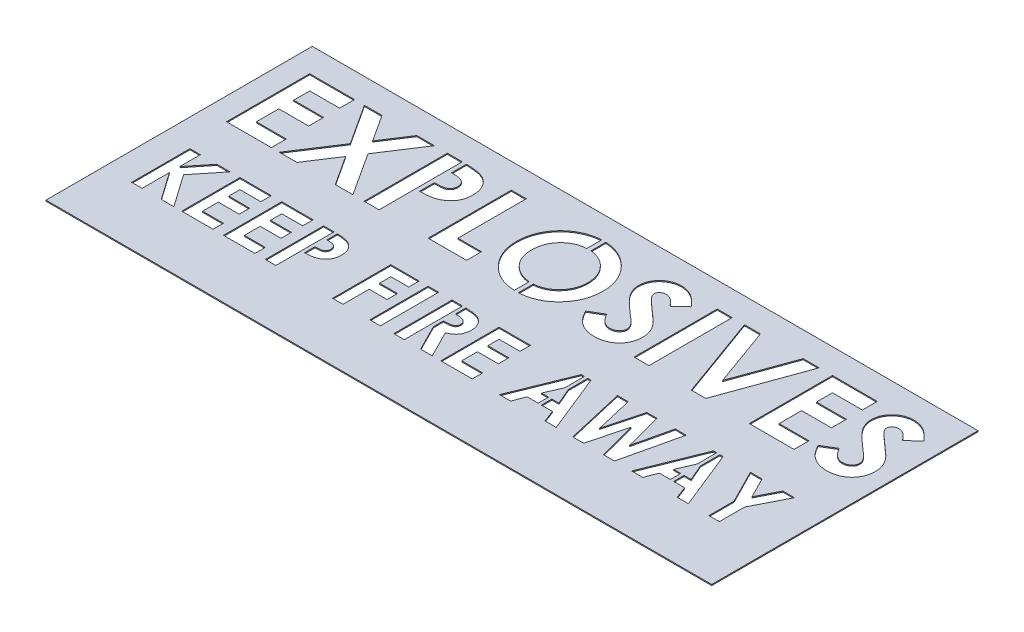
from build123d import *

# Parameters (mm, degrees)
SKETCH1_W           = 254
SKETCH1_H           = 101.6
BOSS_EXTRUDE1_DEPTH = 0.4
SKETCH2_W           = 5.698717948
SKETCH2_H           = 31.75
SKETCH2_W_2         = 3.989102564
SKETCH2_H_2         = 22.225
CUT_EXTRUDE1_DEPTH  = 137.783770967
BOSS_EXTRUDE6_DEPTH = 0.4


with BuildPart() as part:
    # Sketch1 → Boss-Extrude1 (new body)
    with BuildSketch(Plane(origin=(0, 0, 0), x_dir=(1, 0, 0), z_dir=(0, 1, 0))):
        Rectangle(SKETCH1_W, SKETCH1_H)
    extrude(amount=BOSS_EXTRUDE1_DEPTH)

    # Sketch2 → Cut-Extrude1 (cut, through all)
    # profile 1 of 22: a face of its own
    with BuildSketch(Plane(origin=(0, 0.4, 0), x_dir=(1, 0, 0), z_dir=(0, 1, 0))):
        Polygon((-118.451923077, 41.275), (-101.355769231, 41.275), (-101.355769231, 35.576282051), (-112.753205128, 35.576282051), (-112.753205128, 29.470512821), (-101.355769231, 29.470512821), (-101.355769231, 23.771794872), (-112.753205128, 23.771794872), (-112.753205128, 15.223717949), (-101.355769231, 15.223717949), (-101.355769231, 9.525), (-118.451923077, 9.525), align=None)
    # profile 2 of 22: a face of its own
    with BuildSketch(Plane(origin=(0, 0.4, 0), x_dir=(1, 0, 0), z_dir=(0, 1, 0))):
        Polygon((-97.596905048, 41.275), (-90.880558894, 41.275), (-84.246895032, 31.07963742), (-77.600510817, 41.275), (-70.865084135, 41.275), (-80.882361779, 25.915174279), (-70.216346154, 9.525), (-76.932692308, 9.525), (-84.246895032, 20.76343149), (-91.573818109, 9.525), (-98.302884615, 9.525), (-87.605068109, 25.927894631), align=None)
    # profile 3 of 22: a face of its own
    with BuildSketch(Plane(origin=(0, 0.4, 0), x_dir=(1, 0, 0), z_dir=(0, 1, 0))):
        with BuildLine():
            Line((-65.942307692, 41.275), (-59.58213141, 41.275))
            add(Edge.make_bspline(
                [(-59.58213141, 41.275), (-59.166565743, 41.27313984), (-58.364852463, 41.2695512), (-57.208715953, 41.226034175), (-56.142123415, 41.148049016), (-55.165319897, 41.051671692), (-54.278707036, 40.916554434), (-53.481174528, 40.761653077), (-52.772556864, 40.57293814), (-52.144863328, 40.348936126), (-51.581528654, 40.084846504), (-51.04843236, 39.803572205), (-50.557622482, 39.467881249), (-50.084326362, 39.113952983), (-49.655603155, 38.707976774), (-49.244706542, 38.276970928), (-48.869039114, 37.803842109), (-48.526860168, 37.294317413), (-48.216451139, 36.757810678), (-47.945257045, 36.193362789), (-47.725279583, 35.600080566), (-47.540745845, 34.98180187), (-47.392526549, 34.338553648), (-47.293867068, 33.666379866), (-47.226852585, 32.969973897), (-47.220939482, 32.495999555), (-47.217948718, 32.256270032)],
                knots=[0, 0, 0, 0, 1.698747864, 3.27724071, 4.728299578, 6.070144658, 7.288476769, 8.393259625, 9.389771311, 10.283485332, 11.113357557, 11.931608583, 12.74405601, 13.541433047, 14.344816069, 15.154114104, 15.974336324, 16.810834471, 17.661136416, 18.50621059, 19.367396281, 20.244825668, 21.142564693, 22.063065223, 23.020325768, 24, 24, 24, 24], degree=3))
            add(Edge.make_bspline(
                [(-47.217948718, 32.256270032), (-47.222275979, 31.991062969), (-47.230779578, 31.4698985), (-47.314142254, 30.705935328), (-47.456552042, 29.977565612), (-47.642674187, 29.278646879), (-47.902208281, 28.620677892), (-48.198713797, 27.987959309), (-48.56350963, 27.398230617), (-48.980347187, 26.84411502), (-49.435581354, 26.321107297), (-49.94001937, 25.844308307), (-50.484046431, 25.410467727), (-51.064513358, 25.015038875), (-51.683599398, 24.658819418), (-52.34085785, 24.33847374), (-53.040776848, 24.064247489), (-53.52817938, 23.92082938), (-53.775290465, 23.848116987)],
                knots=[0, 0, 0, 0, 1.102006807, 2.165578795, 3.188629044, 4.184801286, 5.166646146, 6.124351954, 7.085497154, 8.042432466, 9.003981491, 9.963833307, 10.922997304, 11.89326795, 12.880200226, 13.889073926, 14.929769137, 16, 16, 16, 16], degree=3))
            add(Edge.make_bspline(
                [(-53.775290465, 23.848116987), (-53.93805204, 23.807621644), (-54.290646025, 23.71989569), (-54.874092224, 23.630831828), (-55.54645271, 23.548943083), (-56.309901664, 23.47856962), (-57.164879232, 23.430732064), (-58.110557572, 23.393373059), (-59.147365251, 23.366209205), (-59.868320312, 23.365245312), (-60.243589744, 23.36474359)],
                knots=[0, 0, 0, 0, 0.618981996, 1.340914327, 2.176866532, 3.120127938, 4.170906482, 5.338178032, 6.614476169, 8, 8, 8, 8], degree=3))
            Line((-60.243589744, 23.36474359), (-60.243589744, 9.525))
            Line((-60.243589744, 9.525), (-65.942307692, 9.525))
            Line((-65.942307692, 9.525), (-65.942307692, 41.275))
        make_face()
        with BuildLine():
            Line((-60.243589744, 29.063461538), (-58.227413862, 29.063461538))
            add(Edge.make_bspline(
                [(-58.227413862, 29.063461538), (-57.86053883, 29.065787811), (-57.18548332, 29.070068187), (-56.263595877, 29.13196491), (-55.522749395, 29.22649371), (-54.937466917, 29.362069869), (-54.475330964, 29.567824643), (-54.076767638, 29.805844171), (-53.734909698, 30.10681333), (-53.438911038, 30.450722091), (-53.20226903, 30.845890494), (-53.038170123, 31.28588399), (-52.9315747, 31.761457844), (-52.921729622, 32.092425768), (-52.916666667, 32.262630208)],
                knots=[0, 0, 0, 0, 1.8619151, 3.425951444, 4.686033666, 5.651700536, 6.461346321, 7.243864085, 7.999046032, 8.762387399, 9.539336099, 10.322741239, 11.137448474, 12, 12, 12, 12], degree=3))
            add(Edge.make_bspline(
                [(-52.916666667, 32.262630208), (-52.921677543, 32.411335611), (-52.931399847, 32.699859846), (-53.002822543, 33.116271883), (-53.116649775, 33.504453803), (-53.281581058, 33.860351561), (-53.494798154, 34.183360428), (-53.754752941, 34.473353161), (-54.05810969, 34.736540199), (-54.292318836, 34.875849119), (-54.411308093, 34.946624599)],
                knots=[0, 0, 0, 0, 1.102301479, 2.1387299, 3.123554645, 4.094223062, 5.036071848, 5.982632524, 6.975082478, 8, 8, 8, 8], degree=3))
            add(Edge.make_bspline(
                [(-54.411308093, 34.946624599), (-54.512098862, 34.997597382), (-54.725493576, 35.105517207), (-55.088925461, 35.230981895), (-55.508320308, 35.336825181), (-55.986509503, 35.424674086), (-56.521585412, 35.49285396), (-57.113452569, 35.544994507), (-57.762981962, 35.565962252), (-58.214690791, 35.572747239), (-58.450020032, 35.576282051)],
                knots=[0, 0, 0, 0, 0.656809284, 1.390599849, 2.23162475, 3.173112763, 4.218524733, 5.370385145, 6.63003504, 8, 8, 8, 8], degree=3))
            Line((-58.450020032, 35.576282051), (-60.243589744, 35.576282051))
            Line((-60.243589744, 35.576282051), (-60.243589744, 29.063461538))
        make_face(mode=Mode.SUBTRACT)
    # profile 4 of 22: a face of its own
    with BuildSketch(Plane(origin=(0, 0.4, 0), x_dir=(1, 0, 0), z_dir=(0, 1, 0))):
        Polygon((-41.519230769, 41.275), (-35.820512821, 41.275), (-35.820512821, 15.223717949), (-26.865384615, 15.223717949), (-26.865384615, 9.525), (-41.519230769, 9.525), align=None)
    # profile 5 of 22: a face of its own
    with BuildSketch(Plane(origin=(0, 0.4, 0), x_dir=(1, 0, 0), z_dir=(0, 1, 0))):
        with BuildLine():
            add(Edge.make_bspline(
                [(-7.059795673, 42.089102564), (-6.507783011, 42.074809968), (-5.417984989, 42.046593145), (-3.815285365, 41.811383908), (-2.27078794, 41.428144177), (-0.78519113, 40.895413232), (0.637785301, 40.19876201), (2.003160668, 39.357941032), (3.306044259, 38.357080305), (4.53308517, 37.219528259), (5.667092273, 35.982490079), (6.64971009, 34.650598551), (7.487650516, 33.258364322), (8.182137783, 31.802056859), (8.711119102, 30.271590538), (9.082327174, 28.674768716), (9.320809969, 27.012045673), (9.348239159, 25.879957913), (9.362179487, 25.304597356)],
                knots=[0, 0, 0, 0, 1.014329547, 2.002516266, 2.970391464, 3.935626869, 4.897733899, 5.877609409, 6.878433252, 7.912639331, 8.949961323, 9.958554974, 10.949718813, 11.932905612, 12.9188844, 13.919928257, 14.942845884, 16, 16, 16, 16], degree=3))
            add(Edge.make_bspline(
                [(9.362179487, 25.304597356), (9.347333641, 24.735719784), (9.318079426, 23.614728276), (9.092063085, 21.96732788), (8.714603823, 20.387611347), (8.194594442, 18.872002951), (7.512702549, 17.42784378), (6.691102874, 16.045913078), (5.708114963, 14.739035494), (4.599592247, 13.507912346), (3.379204938, 12.39040392), (2.086621044, 11.405601549), (0.727808918, 10.571117183), (-0.695242572, 9.887333058), (-2.185585091, 9.356673381), (-3.739537312, 8.982254419), (-5.357003076, 8.754712455), (-6.456958234, 8.725649325), (-7.015274439, 8.710897436)],
                knots=[0, 0, 0, 0, 1.051557043, 2.072126891, 3.067553643, 4.050577992, 5.02905126, 6.015227836, 7.017913613, 8.04756643, 9.074058332, 10.072836633, 11.047628519, 12.017157415, 12.98668631, 13.966869689, 14.968021931, 16, 16, 16, 16], degree=3))
            add(Edge.make_bspline(
                [(-7.015274439, 8.710897436), (-7.599206245, 8.724130608), (-8.746552427, 8.750131981), (-10.4256987, 8.997393173), (-12.03446592, 9.369854904), (-13.559339516, 9.925734056), (-15.015849023, 10.620629738), (-16.393293036, 11.476435432), (-17.691208645, 12.491736853), (-18.902150793, 13.640531755), (-19.999267312, 14.897565346), (-20.96768784, 16.225509862), (-21.784572038, 17.614220976), (-22.449949794, 19.064348633), (-22.974506888, 20.566880643), (-23.344522318, 22.13096786), (-23.563099262, 23.752859034), (-23.593545761, 24.854479941), (-23.608974359, 25.412720353)],
                knots=[0, 0, 0, 0, 1.067978421, 2.098431617, 3.099715153, 4.085208694, 5.062210972, 6.048429807, 7.046490867, 8.072918869, 9.098532598, 10.095778865, 11.076610158, 12.041847152, 13.011192615, 13.984257998, 14.978533688, 16, 16, 16, 16], degree=3))
            add(Edge.make_bspline(
                [(-23.608974359, 25.412720353), (-23.604131976, 25.788275278), (-23.594508526, 26.534629741), (-23.478583932, 27.640688957), (-23.311685847, 28.725159383), (-23.064851497, 29.783717218), (-22.765010851, 30.823830097), (-22.376524938, 31.83581639), (-21.934322835, 32.830486895), (-21.417651313, 33.796093307), (-20.843162539, 34.72375124), (-20.216344137, 35.60908477), (-19.535619983, 36.441388921), (-18.803182914, 37.226133252), (-18.016508852, 37.958159582), (-17.185945682, 38.647830762), (-16.295385315, 39.276826675), (-15.364319323, 39.860508654), (-14.397996842, 40.388322146), (-13.400351682, 40.837581204), (-12.391937303, 41.229911488), (-11.359282648, 41.539555895), (-10.313454451, 41.791758025), (-9.243280154, 41.958543622), (-8.158428175, 42.074465005), (-7.426875598, 42.084211798), (-7.059795673, 42.089102564)],
                knots=[0, 0, 0, 0, 1.034744296, 2.056386356, 3.06226378, 4.057406941, 5.050368692, 6.043467995, 7.042652155, 8.049140477, 9.059438543, 10.048523776, 11.036952808, 12.020949711, 13.004946614, 13.997082645, 14.994316842, 16.007702937, 17.024872941, 18.026463647, 19.021641123, 20.005082605, 20.995858141, 21.984425357, 22.988620895, 24, 24, 24, 24], degree=3))
        make_face()
        with BuildLine():
            add(Edge.make_bspline(
                [(-7.148838141, 36.390384615), (-7.520342589, 36.380416317), (-8.253543707, 36.360742885), (-9.32901622, 36.21085794), (-10.361507813, 35.971474647), (-11.345294976, 35.624730871), (-12.284641529, 35.183414049), (-13.181212643, 34.649066195), (-14.02259266, 34.003319699), (-14.820000571, 33.280841811), (-15.540327403, 32.475835408), (-16.176758883, 31.613134142), (-16.709349523, 30.694178709), (-17.155397521, 29.727505988), (-17.491172805, 28.702246), (-17.730335472, 27.626429717), (-17.881477351, 26.498203456), (-17.900528972, 25.729093082), (-17.91025641, 25.336398237)],
                knots=[0, 0, 0, 0, 1.033739768, 2.040188636, 3.016340934, 3.979330865, 4.937572243, 5.900995986, 6.878200029, 7.884839167, 8.891893314, 9.879764717, 10.863503415, 11.843163062, 12.837761627, 13.859916423, 14.907309254, 16, 16, 16, 16], degree=3))
            add(Edge.make_bspline(
                [(-17.91025641, 25.336398237), (-17.897359312, 24.901204014), (-17.872083138, 24.048295444), (-17.694236897, 22.804095402), (-17.389959683, 21.629071949), (-16.950589303, 20.528971949), (-16.40565476, 19.491579615), (-15.728932545, 18.529609666), (-14.931382354, 17.637302275), (-14.316956148, 17.116336052), (-14.005108173, 16.851923077)],
                knots=[0, 0, 0, 0, 1.078454662, 2.113592447, 3.107694534, 4.079536787, 5.043276885, 6.005368276, 6.987637804, 8, 8, 8, 8], degree=3))
            add(Edge.make_bspline(
                [(-14.005108173, 16.851923077), (-13.749645146, 16.656584926), (-13.244474719, 16.270309627), (-12.438112731, 15.775218587), (-11.607718665, 15.350876179), (-10.747026154, 15.008012532), (-9.857852938, 14.738321751), (-8.940320949, 14.549461732), (-7.995730253, 14.430935737), (-7.356953756, 14.416769635), (-7.034354968, 14.409615385)],
                knots=[0, 0, 0, 0, 1.023928204, 2.024787132, 3.009472467, 3.9914905, 4.972207045, 5.96565515, 6.972602802, 8, 8, 8, 8], degree=3))
            add(Edge.make_bspline(
                [(-7.034354968, 14.409615385), (-6.669238548, 14.419668203), (-5.950860508, 14.43944744), (-4.895408497, 14.587487219), (-3.884253414, 14.838023974), (-2.911117922, 15.18172599), (-1.978808109, 15.628583927), (-1.091880429, 16.179505575), (-0.248779853, 16.827726327), (0.54761217, 17.559691932), (1.275552126, 18.367869504), (1.910655505, 19.23517233), (2.460179866, 20.142491133), (2.896952289, 21.102667635), (3.245993296, 22.106638219), (3.482277516, 23.158849255), (3.6346962, 24.254963129), (3.65375319, 25.000907356), (3.663461538, 25.380919471)],
                knots=[0, 0, 0, 0, 1.026359118, 2.019393844, 2.989460624, 3.950973911, 4.916101784, 5.890408035, 6.881132271, 7.902007068, 8.92769091, 9.933912415, 10.920395702, 11.90457117, 12.894218921, 13.903490204, 14.931958862, 16, 16, 16, 16], degree=3))
            add(Edge.make_bspline(
                [(3.663461538, 25.380919471), (3.653417279, 25.758746412), (3.633646687, 26.502441122), (3.485346349, 27.595736895), (3.236398433, 28.643302727), (2.891664316, 29.646849405), (2.451457103, 30.607360777), (1.907096227, 31.521459116), (1.260491782, 32.388260714), (0.52652533, 33.201858648), (-0.272352043, 33.949503034), (-1.130026726, 34.598322454), (-2.022500019, 35.1621259), (-2.970249613, 35.603786754), (-3.953885345, 35.955657019), (-4.979409412, 36.214779332), (-6.05070605, 36.359689936), (-6.779531304, 36.380061854), (-7.148838141, 36.390384615)],
                knots=[0, 0, 0, 0, 1.055025985, 2.07665775, 3.074803781, 4.057872707, 5.035505728, 6.020516407, 7.023567878, 8.050795229, 9.077271434, 10.074415901, 11.050397877, 12.019801805, 12.988065821, 13.964604439, 14.968634123, 16, 16, 16, 16], degree=3))
        make_face(mode=Mode.SUBTRACT)
    # profile 6 of 22: a face of its own
    with BuildSketch(Plane(origin=(0, 0.4, 0), x_dir=(1, 0, 0), z_dir=(0, 1, 0))):
        with BuildLine():
            Line((31.342948718, 37.03276242), (27.081630609, 33.133974359))
            add(Edge.make_bspline(
                [(27.081630609, 33.133974359), (26.899094013, 33.391461204), (26.548649205, 33.885800038), (25.980614724, 34.547731389), (25.415145209, 35.112408091), (24.84700193, 35.577471187), (24.271149081, 35.940095072), (23.688586259, 36.196836789), (23.102616174, 36.360049934), (22.70893473, 36.380373898), (22.515024038, 36.390384615)],
                knots=[0, 0, 0, 0, 1.299362458, 2.494594718, 3.587462134, 4.587049575, 5.512617175, 6.380583204, 7.202344345, 8, 8, 8, 8], degree=3))
            add(Edge.make_bspline(
                [(22.515024038, 36.390384615), (22.334149708, 36.384041365), (21.984928897, 36.371794216), (21.487088722, 36.250058467), (21.045099126, 36.039960441), (20.659391469, 35.765239597), (20.353854098, 35.43426467), (20.109906202, 35.087157073), (19.972543037, 34.704028785), (19.954463342, 34.440880823), (19.945512821, 34.310606971)],
                knots=[0, 0, 0, 0, 1.185010067, 2.2879431, 3.333075148, 4.379039566, 5.372662701, 6.27520591, 7.14612461, 8, 8, 8, 8], degree=3))
            add(Edge.make_bspline(
                [(19.945512821, 34.310606971), (19.951121659, 34.178454513), (19.962417079, 33.912317826), (20.071515466, 33.522261368), (20.235957887, 33.141130802), (20.393089334, 32.909118491), (20.473407452, 32.79052484)],
                knots=[0, 0, 0, 0, 0.967525499, 1.948461899, 2.951351359, 4, 4, 4, 4], degree=3))
            add(Edge.make_bspline(
                [(20.473407452, 32.79052484), (20.546425309, 32.698343235), (20.714502773, 32.486153356), (21.034992073, 32.150077663), (21.437459326, 31.738355523), (21.937392318, 31.265144852), (22.514037457, 30.713427144), (23.194122989, 30.104890634), (23.958073087, 29.420689651), (24.501071117, 28.944236863), (24.785606971, 28.694571314)],
                knots=[0, 0, 0, 0, 0.473873513, 1.090794244, 1.870441696, 2.795289791, 3.865433203, 5.087734844, 6.473946851, 8, 8, 8, 8], degree=3))
            add(Edge.make_bspline(
                [(24.785606971, 28.694571314), (25.0526848, 28.463428924), (25.559543033, 28.02476869), (26.280701645, 27.402160919), (26.914479957, 26.842015889), (27.470110673, 26.352740177), (27.939170974, 25.929200162), (28.32363279, 25.569371327), (28.62819167, 25.280258878), (28.801315561, 25.105634783), (28.875200321, 25.031109776)],
                knots=[0, 0, 0, 0, 1.543621617, 2.929473131, 4.163658386, 5.240097082, 6.164993805, 6.925417477, 7.541396219, 8, 8, 8, 8], degree=3))
            add(Edge.make_bspline(
                [(28.875200321, 25.031109776), (29.155503694, 24.727761493), (29.694345216, 24.144619564), (30.39464924, 23.240932967), (30.971022105, 22.358750583), (31.416915083, 21.48147272), (31.753671394, 20.596442003), (31.991089054, 19.681953103), (32.13328007, 18.728450184), (32.149066593, 18.077800842), (32.157051282, 17.748707933)],
                knots=[0, 0, 0, 0, 1.206664779, 2.319633467, 3.337109185, 4.282041471, 5.190008762, 6.099243693, 7.03861361, 8, 8, 8, 8], degree=3))
            add(Edge.make_bspline(
                [(32.157051282, 17.748707933), (32.151367985, 17.428047253), (32.140217144, 16.798899064), (32.00364073, 15.878234405), (31.808890781, 14.997118368), (31.507773193, 14.165138743), (31.14077286, 13.368638837), (30.680684938, 12.620025586), (30.140374761, 11.911722718), (29.521096338, 11.256392013), (28.836100865, 10.661724821), (28.10137812, 10.132338041), (27.309743614, 9.695261822), (26.467960946, 9.335360732), (25.576480705, 9.058160101), (24.636364912, 8.853282999), (23.646175595, 8.730318992), (22.969069872, 8.717464564), (22.623147035, 8.710897436)],
                knots=[0, 0, 0, 0, 1.043214005, 2.046824704, 3.02475056, 3.976699089, 4.921714032, 5.875962561, 6.831408892, 7.817874052, 8.806269674, 9.781291748, 10.760897367, 11.74438705, 12.757449933, 13.795994037, 14.874007457, 16, 16, 16, 16], degree=3))
            add(Edge.make_bspline(
                [(22.623147035, 8.710897436), (22.351600554, 8.715714851), (21.813782789, 8.725256097), (21.021120712, 8.803152424), (20.255715872, 8.928868808), (19.518430427, 9.109057942), (18.805942778, 9.337382013), (18.118223663, 9.616271119), (17.460020636, 9.950047936), (16.82635342, 10.331848687), (16.220302421, 10.775169651), (15.634204361, 11.270947276), (15.073880924, 11.826806844), (14.536640988, 12.441433769), (14.025921966, 13.116568525), (13.525006191, 13.842808613), (13.056155867, 14.633632063), (12.766526166, 15.18840111), (12.618589744, 15.471764824)],
                knots=[0, 0, 0, 0, 1.016823716, 2.013894106, 2.979844003, 3.91962641, 4.853723003, 5.779685073, 6.695824784, 7.614987388, 8.547259901, 9.504950863, 10.487499108, 11.500346958, 12.559593716, 13.656357062, 14.802919212, 16, 16, 16, 16], degree=3))
            Line((12.618589744, 15.471764824), (17.630408654, 18.480128205))
            add(Edge.make_bspline(
                [(17.630408654, 18.480128205), (17.815455007, 18.158473366), (18.170204682, 17.541833548), (18.771361171, 16.713299799), (19.387215304, 16.00379779), (20.032005077, 15.425868016), (20.697890087, 14.971782811), (21.388086713, 14.647262021), (22.103079876, 14.44638402), (22.590100736, 14.421852176), (22.833032853, 14.409615385)],
                knots=[0, 0, 0, 0, 1.283663364, 2.460892379, 3.537111102, 4.529833553, 5.449777664, 6.316464042, 7.160231139, 8, 8, 8, 8], degree=3))
            add(Edge.make_bspline(
                [(22.833032853, 14.409615385), (23.080129595, 14.419608612), (23.559533262, 14.438996929), (24.24382065, 14.618080963), (24.871201238, 14.899256035), (25.413504384, 15.30045409), (25.872692496, 15.763497623), (26.21159968, 16.278654725), (26.424503459, 16.836042275), (26.44701255, 17.223240331), (26.458333333, 17.417978766)],
                knots=[0, 0, 0, 0, 1.13588714, 2.203786484, 3.234766741, 4.283437687, 5.291419208, 6.222934724, 7.106237994, 8, 8, 8, 8], degree=3))
            add(Edge.make_bspline(
                [(26.458333333, 17.417978766), (26.447879054, 17.59915119), (26.426642185, 17.967185626), (26.270217956, 18.514393651), (26.025679173, 19.061352817), (25.73637255, 19.509983522), (25.441966834, 19.885609851), (25.160448567, 20.211073073), (24.817633788, 20.570652955), (24.414391724, 20.964801822), (23.956050256, 21.396989465), (23.442223289, 21.867173564), (22.867026962, 22.371212358), (22.460477063, 22.714558605), (22.247896635, 22.894090545)],
                knots=[0, 0, 0, 0, 0.916159276, 1.861089862, 2.860218735, 3.940849679, 4.552606315, 5.27541173, 6.11797699, 7.06649574, 8.129236253, 9.306560635, 10.591630461, 12, 12, 12, 12], degree=3))
            add(Edge.make_bspline(
                [(22.247896635, 22.894090545), (21.843772779, 23.236018079), (21.068136782, 23.89228051), (19.972064711, 24.861559461), (18.984405635, 25.767439456), (18.113690037, 26.62111915), (17.348823653, 27.406833059), (16.694986492, 28.13096305), (16.159361252, 28.799094798), (15.595731182, 29.590452142), (15.060169925, 30.554775442), (14.59729302, 31.714968162), (14.29699802, 32.87501367), (14.263354142, 33.65380433), (14.246794872, 34.037119391)],
                knots=[0, 0, 0, 0, 1.345494975, 2.582412109, 3.71882943, 4.751509156, 5.681369928, 6.505683931, 7.230279997, 7.856715994, 8.973648664, 10.023341002, 11.027102913, 12, 12, 12, 12], degree=3))
            add(Edge.make_bspline(
                [(14.246794872, 34.037119391), (14.25368185, 34.308945858), (14.267249938, 34.844473198), (14.388279371, 35.631888123), (14.569162471, 36.391677364), (14.831856661, 37.121068864), (15.172802002, 37.819149031), (15.586866874, 38.489335261), (16.080480921, 39.125459312), (16.636750628, 39.727099478), (17.249617425, 40.276930123), (17.904543481, 40.76221076), (18.597821858, 41.172085843), (19.325211429, 41.512106986), (20.091219525, 41.772371571), (20.890202999, 41.956860082), (21.723307847, 42.066587965), (22.289967782, 42.081504197), (22.578625801, 42.089102564)],
                knots=[0, 0, 0, 0, 1.010766082, 1.991317756, 2.957454644, 3.913069143, 4.869106762, 5.843196583, 6.838735724, 7.860187025, 8.887984031, 9.89767229, 10.887916223, 11.879572884, 12.879850636, 13.892031539, 14.926195476, 16, 16, 16, 16], degree=3))
            add(Edge.make_bspline(
                [(22.578625801, 42.089102564), (22.952712308, 42.075417683), (23.697932413, 42.048155944), (24.799761832, 41.834978052), (25.875982742, 41.499733361), (26.74322172, 41.095297526), (27.433267588, 40.703520341), (27.962123286, 40.34282126), (28.500262425, 39.929621077), (29.052024763, 39.462617688), (29.607157703, 38.933012136), (30.181446327, 38.3534121), (30.767065253, 37.718808477), (31.147624702, 37.265450592), (31.342948718, 37.03276242)],
                knots=[0, 0, 0, 0, 1.282922637, 2.555718331, 3.837320111, 5.142675274, 5.830281639, 6.55870424, 7.337177975, 8.157850921, 9.037902056, 9.96903443, 10.957596896, 12, 12, 12, 12], degree=3))
        make_face()
    # profile 7 of 22: a face of its own
    with BuildSketch(Plane(origin=(0, 0.4, 0), x_dir=(1, 0, 0), z_dir=(0, 1, 0))):
        with Locations((39.891025641, 25.4)):
            Rectangle(SKETCH2_W, SKETCH2_H)
    # profile 8 of 22: a face of its own
    with BuildSketch(Plane(origin=(0, 0.4, 0), x_dir=(1, 0, 0), z_dir=(0, 1, 0))):
        Polygon((47.421474359, 41.275), (53.508163061, 41.275), (61.668269231, 18.721814904), (69.834735577, 41.275), (75.915064103, 41.275), (64.409505208, 9.525), (58.914312901, 9.525), align=None)
    # profile 9 of 22: a face of its own
    with BuildSketch(Plane(origin=(0, 0.4, 0), x_dir=(1, 0, 0), z_dir=(0, 1, 0))):
        Polygon((81.003205128, 41.275), (98.099358974, 41.275), (98.099358974, 35.576282051), (86.701923077, 35.576282051), (86.701923077, 29.470512821), (98.099358974, 29.470512821), (98.099358974, 23.771794872), (86.701923077, 23.771794872), (86.701923077, 15.223717949), (98.099358974, 15.223717949), (98.099358974, 9.525), (81.003205128, 9.525), align=None)
    # profile 10 of 22: a face of its own
    with BuildSketch(Plane(origin=(0, 0.4, 0), x_dir=(1, 0, 0), z_dir=(0, 1, 0))):
        with BuildLine():
            Line((120.080128205, 37.03276242), (115.818810096, 33.133974359))
            add(Edge.make_bspline(
                [(115.818810096, 33.133974359), (115.6362735, 33.391461204), (115.285828692, 33.885800038), (114.717794211, 34.547731389), (114.152324696, 35.112408091), (113.584181418, 35.577471187), (113.008328569, 35.940095072), (112.425765746, 36.196836789), (111.839795661, 36.360049934), (111.446114217, 36.380373898), (111.252203526, 36.390384615)],
                knots=[0, 0, 0, 0, 1.299362458, 2.494594718, 3.587462134, 4.587049575, 5.512617175, 6.380583204, 7.202344345, 8, 8, 8, 8], degree=3))
            add(Edge.make_bspline(
                [(111.252203526, 36.390384615), (111.071329195, 36.384041365), (110.722108384, 36.371794216), (110.22426821, 36.250058467), (109.782278613, 36.039960441), (109.396570956, 35.765239597), (109.091033586, 35.43426467), (108.847085689, 35.087157073), (108.709722524, 34.704028785), (108.691642829, 34.440880823), (108.682692308, 34.310606971)],
                knots=[0, 0, 0, 0, 1.185010067, 2.2879431, 3.333075148, 4.379039566, 5.372662701, 6.27520591, 7.14612461, 8, 8, 8, 8], degree=3))
            add(Edge.make_bspline(
                [(108.682692308, 34.310606971), (108.688301146, 34.178454513), (108.699596566, 33.912317826), (108.808694954, 33.522261368), (108.973137375, 33.141130802), (109.130268822, 32.909118491), (109.210586939, 32.79052484)],
                knots=[0, 0, 0, 0, 0.967525499, 1.948461899, 2.951351359, 4, 4, 4, 4], degree=3))
            add(Edge.make_bspline(
                [(109.210586939, 32.79052484), (109.283604796, 32.698343235), (109.451682261, 32.486153356), (109.772171561, 32.150077663), (110.174638813, 31.738355523), (110.674571805, 31.265144852), (111.251216944, 30.713427144), (111.931302476, 30.104890634), (112.695252574, 29.420689651), (113.238250604, 28.944236863), (113.522786458, 28.694571314)],
                knots=[0, 0, 0, 0, 0.473873513, 1.090794244, 1.870441696, 2.795289791, 3.865433203, 5.087734844, 6.473946851, 8, 8, 8, 8], degree=3))
            add(Edge.make_bspline(
                [(113.522786458, 28.694571314), (113.789864288, 28.463428924), (114.29672252, 28.02476869), (115.017881132, 27.402160919), (115.651659444, 26.842015889), (116.207290161, 26.352740177), (116.676350461, 25.929200162), (117.060812277, 25.569371327), (117.365371157, 25.280258878), (117.538495048, 25.105634783), (117.612379808, 25.031109776)],
                knots=[0, 0, 0, 0, 1.543621617, 2.929473131, 4.163658386, 5.240097082, 6.164993805, 6.925417477, 7.541396219, 8, 8, 8, 8], degree=3))
            add(Edge.make_bspline(
                [(117.612379808, 25.031109776), (117.892683181, 24.727761493), (118.431524703, 24.144619564), (119.131828728, 23.240932967), (119.708201592, 22.358750583), (120.15409457, 21.48147272), (120.490850881, 20.596442003), (120.728268541, 19.681953103), (120.870459558, 18.728450184), (120.88624608, 18.077800842), (120.894230769, 17.748707933)],
                knots=[0, 0, 0, 0, 1.206664779, 2.319633467, 3.337109185, 4.282041471, 5.190008762, 6.099243693, 7.03861361, 8, 8, 8, 8], degree=3))
            add(Edge.make_bspline(
                [(120.894230769, 17.748707933), (120.888547472, 17.428047253), (120.877396631, 16.798899064), (120.740820218, 15.878234405), (120.546070268, 14.997118368), (120.24495268, 14.165138743), (119.877952348, 13.368638837), (119.417864426, 12.620025586), (118.877554248, 11.911722718), (118.258275825, 11.256392013), (117.573280352, 10.661724821), (116.838557607, 10.132338041), (116.046923101, 9.695261822), (115.205140433, 9.335360732), (114.313660192, 9.058160101), (113.373544399, 8.853282999), (112.383355083, 8.730318992), (111.706249359, 8.717464564), (111.360326522, 8.710897436)],
                knots=[0, 0, 0, 0, 1.043214005, 2.046824704, 3.02475056, 3.976699089, 4.921714032, 5.875962561, 6.831408892, 7.817874052, 8.806269674, 9.781291748, 10.760897367, 11.74438705, 12.757449933, 13.795994037, 14.874007457, 16, 16, 16, 16], degree=3))
            add(Edge.make_bspline(
                [(111.360326522, 8.710897436), (111.088780041, 8.715714851), (110.550962276, 8.725256097), (109.7583002, 8.803152424), (108.992895359, 8.928868808), (108.255609914, 9.109057942), (107.543122265, 9.337382013), (106.85540315, 9.616271119), (106.197200123, 9.950047936), (105.563532908, 10.331848687), (104.957481908, 10.775169651), (104.371383848, 11.270947276), (103.811060411, 11.826806844), (103.273820475, 12.441433769), (102.763101453, 13.116568525), (102.262185678, 13.842808613), (101.793335354, 14.633632063), (101.503705653, 15.18840111), (101.355769231, 15.471764824)],
                knots=[0, 0, 0, 0, 1.016823716, 2.013894106, 2.979844003, 3.91962641, 4.853723003, 5.779685073, 6.695824784, 7.614987388, 8.547259901, 9.504950863, 10.487499108, 11.500346958, 12.559593716, 13.656357062, 14.802919212, 16, 16, 16, 16], degree=3))
            Line((101.355769231, 15.471764824), (106.367588141, 18.480128205))
            add(Edge.make_bspline(
                [(106.367588141, 18.480128205), (106.552634495, 18.158473366), (106.90738417, 17.541833548), (107.508540658, 16.713299799), (108.124394791, 16.00379779), (108.769184564, 15.425868016), (109.435069574, 14.971782811), (110.125266201, 14.647262021), (110.840259363, 14.44638402), (111.327280223, 14.421852176), (111.57021234, 14.409615385)],
                knots=[0, 0, 0, 0, 1.283663364, 2.460892379, 3.537111102, 4.529833553, 5.449777664, 6.316464042, 7.160231139, 8, 8, 8, 8], degree=3))
            add(Edge.make_bspline(
                [(111.57021234, 14.409615385), (111.817309082, 14.419608612), (112.296712749, 14.438996929), (112.981000137, 14.618080963), (113.608380725, 14.899256035), (114.150683871, 15.30045409), (114.609871983, 15.763497623), (114.948779167, 16.278654725), (115.161682946, 16.836042275), (115.184192037, 17.223240331), (115.195512821, 17.417978766)],
                knots=[0, 0, 0, 0, 1.13588714, 2.203786484, 3.234766741, 4.283437687, 5.291419208, 6.222934724, 7.106237994, 8, 8, 8, 8], degree=3))
            add(Edge.make_bspline(
                [(115.195512821, 17.417978766), (115.185058541, 17.59915119), (115.163821672, 17.967185626), (115.007397443, 18.514393651), (114.762858661, 19.061352817), (114.473552037, 19.509983522), (114.179146322, 19.885609851), (113.897628054, 20.211073073), (113.554813275, 20.570652955), (113.151571211, 20.964801822), (112.693229743, 21.396989465), (112.179402776, 21.867173564), (111.604206449, 22.371212358), (111.19765655, 22.714558605), (110.985076122, 22.894090545)],
                knots=[0, 0, 0, 0, 0.916159276, 1.861089862, 2.860218735, 3.940849679, 4.552606315, 5.27541173, 6.11797699, 7.06649574, 8.129236253, 9.306560635, 10.591630461, 12, 12, 12, 12], degree=3))
            add(Edge.make_bspline(
                [(110.985076122, 22.894090545), (110.580952267, 23.236018079), (109.805316269, 23.89228051), (108.709244199, 24.861559461), (107.721585122, 25.767439456), (106.850869524, 26.62111915), (106.086003141, 27.406833059), (105.432165979, 28.13096305), (104.896540739, 28.799094798), (104.332910669, 29.590452142), (103.797349412, 30.554775442), (103.334472507, 31.714968162), (103.034177508, 32.87501367), (103.000533629, 33.65380433), (102.983974359, 34.037119391)],
                knots=[0, 0, 0, 0, 1.345494975, 2.582412109, 3.71882943, 4.751509156, 5.681369928, 6.505683931, 7.230279997, 7.856715994, 8.973648664, 10.023341002, 11.027102913, 12, 12, 12, 12], degree=3))
            add(Edge.make_bspline(
                [(102.983974359, 34.037119391), (102.990861338, 34.308945858), (103.004429425, 34.844473198), (103.125458859, 35.631888123), (103.306341958, 36.391677364), (103.569036149, 37.121068864), (103.909981489, 37.819149031), (104.324046361, 38.489335261), (104.817660408, 39.125459312), (105.373930116, 39.727099478), (105.986796912, 40.276930123), (106.641722968, 40.76221076), (107.335001345, 41.172085843), (108.062390916, 41.512106986), (108.828399012, 41.772371571), (109.627382486, 41.956860082), (110.460487334, 42.066587965), (111.027147269, 42.081504197), (111.315805288, 42.089102564)],
                knots=[0, 0, 0, 0, 1.010766082, 1.991317756, 2.957454644, 3.913069143, 4.869106762, 5.843196583, 6.838735724, 7.860187025, 8.887984031, 9.89767229, 10.887916223, 11.879572884, 12.879850636, 13.892031539, 14.926195476, 16, 16, 16, 16], degree=3))
            add(Edge.make_bspline(
                [(111.315805288, 42.089102564), (111.689891795, 42.075417683), (112.4351119, 42.048155944), (113.536941319, 41.834978052), (114.613162229, 41.499733361), (115.480401208, 41.095297526), (116.170447075, 40.703520341), (116.699302773, 40.34282126), (117.237441912, 39.929621077), (117.789204251, 39.462617688), (118.34433719, 38.933012136), (118.918625815, 38.3534121), (119.50424474, 37.718808477), (119.884804189, 37.265450592), (120.080128205, 37.03276242)],
                knots=[0, 0, 0, 0, 1.282922637, 2.555718331, 3.837320111, 5.142675274, 5.830281639, 6.55870424, 7.337177975, 8.157850921, 9.037902056, 9.96903443, 10.957596896, 12, 12, 12, 12], degree=3))
        make_face()
    # profile 11 of 22: a face of its own
    with BuildSketch(Plane(origin=(0, 0.4, 0), x_dir=(1, 0, 0), z_dir=(0, 1, 0))):
        Polygon((-116.538782051, -6.35), (-112.549679487, -6.35), (-112.549679487, -14.172380809), (-106.245472756, -6.35), (-101.210121194, -6.35), (-109.130448718, -16.180288462), (-100.439903846, -28.575), (-105.243744992, -28.575), (-112.549679487, -18.152579127), (-112.549679487, -28.575), (-116.538782051, -28.575), align=None)
    # profile 12 of 22: a face of its own
    with BuildSketch(Plane(origin=(0, 0.4, 0), x_dir=(1, 0, 0), z_dir=(0, 1, 0))):
        Polygon((-97.448076923, -6.35), (-85.480769231, -6.35), (-85.480769231, -10.339102564), (-93.458974359, -10.339102564), (-93.458974359, -14.613141026), (-85.480769231, -14.613141026), (-85.480769231, -18.60224359), (-93.458974359, -18.60224359), (-93.458974359, -24.585897436), (-85.480769231, -24.585897436), (-85.480769231, -28.575), (-97.448076923, -28.575), align=None)
    # profile 13 of 22: a face of its own
    with BuildSketch(Plane(origin=(0, 0.4, 0), x_dir=(1, 0, 0), z_dir=(0, 1, 0))):
        Polygon((-81.491666667, -6.35), (-69.524358974, -6.35), (-69.524358974, -10.339102564), (-77.502564103, -10.339102564), (-77.502564103, -14.613141026), (-69.524358974, -14.613141026), (-69.524358974, -18.60224359), (-77.502564103, -18.60224359), (-77.502564103, -24.585897436), (-69.524358974, -24.585897436), (-69.524358974, -28.575), (-81.491666667, -28.575), align=None)
    # profile 14 of 22: a face of its own
    with BuildSketch(Plane(origin=(0, 0.4, 0), x_dir=(1, 0, 0), z_dir=(0, 1, 0))):
        with BuildLine():
            Line((-65.53525641, -6.35), (-61.083133013, -6.35))
            add(Edge.make_bspline(
                [(-61.083133013, -6.35), (-60.792237046, -6.351302112), (-60.23103775, -6.35381416), (-59.421742193, -6.384276077), (-58.675127416, -6.438865689), (-57.991364954, -6.506329815), (-57.370735951, -6.600911896), (-56.812463195, -6.709342846), (-56.31643083, -6.841443302), (-55.877045355, -6.998244711), (-55.482711083, -7.183107447), (-55.109543678, -7.379999457), (-54.765976763, -7.614983126), (-54.434669479, -7.862732912), (-54.134563234, -8.146916258), (-53.846935605, -8.44862035), (-53.583968405, -8.779810524), (-53.344443143, -9.136477811), (-53.127156823, -9.512032525), (-52.937320957, -9.907146048), (-52.783336734, -10.322443604), (-52.654163117, -10.755238691), (-52.55040961, -11.205512446), (-52.481347973, -11.676034093), (-52.434437835, -12.163518272), (-52.430298663, -12.495300312), (-52.428205128, -12.663110978)],
                knots=[0, 0, 0, 0, 1.698747864, 3.27724071, 4.728299578, 6.070144658, 7.288476769, 8.393259625, 9.389771311, 10.283485332, 11.113357557, 11.931608583, 12.74405601, 13.541433047, 14.344816069, 15.154114104, 15.974336324, 16.810834471, 17.661136416, 18.50621059, 19.367396281, 20.244825668, 21.142564693, 22.063065223, 23.020325768, 24, 24, 24, 24], degree=3))
            add(Edge.make_bspline(
                [(-52.428205128, -12.663110978), (-52.431234211, -12.848755922), (-52.43718673, -13.21357105), (-52.495540603, -13.74834527), (-52.595227455, -14.258204072), (-52.725512957, -14.747447185), (-52.907186823, -15.208025476), (-53.114740683, -15.650928484), (-53.370097766, -16.063738568), (-53.661884056, -16.451619486), (-53.980547973, -16.817724892), (-54.333654585, -17.151484185), (-54.714473527, -17.455172591), (-55.120800376, -17.731972787), (-55.554160604, -17.981326407), (-56.014241521, -18.205568382), (-56.504184819, -18.397526758), (-56.845366592, -18.497919434), (-57.018344351, -18.548818109)],
                knots=[0, 0, 0, 0, 1.102006807, 2.165578795, 3.188629044, 4.184801286, 5.166646146, 6.124351954, 7.085497154, 8.042432466, 9.003981491, 9.963833307, 10.922997304, 11.89326795, 12.880200226, 13.889073926, 14.929769137, 16, 16, 16, 16], degree=3))
            add(Edge.make_bspline(
                [(-57.018344351, -18.548818109), (-57.132277454, -18.577164849), (-57.379093243, -18.638573017), (-57.787505583, -18.70091772), (-58.258157923, -18.758239842), (-58.79257219, -18.807501266), (-59.391056488, -18.840987555), (-60.053031326, -18.867138858), (-60.778796701, -18.886153556), (-61.283465244, -18.886828281), (-61.546153846, -18.887179487)],
                knots=[0, 0, 0, 0, 0.618981996, 1.340914327, 2.176866532, 3.120127938, 4.170906482, 5.338178032, 6.614476169, 8, 8, 8, 8], degree=3))
            Line((-61.546153846, -18.887179487), (-61.546153846, -28.575))
            Line((-61.546153846, -28.575), (-65.53525641, -28.575))
            Line((-65.53525641, -28.575), (-65.53525641, -6.35))
        make_face()
        with BuildLine():
            Line((-61.546153846, -14.898076923), (-60.134830729, -14.898076923))
            add(Edge.make_bspline(
                [(-60.134830729, -14.898076923), (-59.878018206, -14.896448532), (-59.405479349, -14.893452269), (-58.760158139, -14.850124563), (-58.241565602, -14.783954403), (-57.831867867, -14.689051092), (-57.508372701, -14.54502275), (-57.229378372, -14.378409081), (-56.990077814, -14.167730669), (-56.782878752, -13.926994536), (-56.617229347, -13.650376654), (-56.502360112, -13.342381207), (-56.427743316, -13.00947951), (-56.420851761, -12.777801962), (-56.417307692, -12.658658854)],
                knots=[0, 0, 0, 0, 1.8619151, 3.425951444, 4.686033666, 5.651700536, 6.461346321, 7.243864085, 7.999046032, 8.762387399, 9.539336099, 10.322741239, 11.137448474, 12, 12, 12, 12], degree=3))
            add(Edge.make_bspline(
                [(-56.417307692, -12.658658854), (-56.420815306, -12.554565072), (-56.427620919, -12.352598107), (-56.477616806, -12.061109682), (-56.557295868, -11.789382338), (-56.672747766, -11.540253908), (-56.821999733, -11.3141477), (-57.003968084, -11.111152787), (-57.216317808, -10.92692186), (-57.380264211, -10.829405617), (-57.463556691, -10.77986278)],
                knots=[0, 0, 0, 0, 1.102301479, 2.1387299, 3.123554645, 4.094223062, 5.036071848, 5.982632524, 6.975082478, 8, 8, 8, 8], degree=3))
            add(Edge.make_bspline(
                [(-57.463556691, -10.77986278), (-57.534110229, -10.744181833), (-57.683486529, -10.668637955), (-57.937888849, -10.580812673), (-58.231465241, -10.506722373), (-58.566197677, -10.44522814), (-58.940750814, -10.397502228), (-59.355057824, -10.361003845), (-59.809728399, -10.346326424), (-60.125924579, -10.341576933), (-60.290655048, -10.339102564)],
                knots=[0, 0, 0, 0, 0.656809284, 1.390599849, 2.23162475, 3.173112763, 4.218524733, 5.370385145, 6.63003504, 8, 8, 8, 8], degree=3))
            Line((-60.290655048, -10.339102564), (-61.546153846, -10.339102564))
            Line((-61.546153846, -10.339102564), (-61.546153846, -14.898076923))
        make_face(mode=Mode.SUBTRACT)
    # profile 15 of 22: a face of its own
    with BuildSketch(Plane(origin=(0, 0.4, 0), x_dir=(1, 0, 0), z_dir=(0, 1, 0))):
        Polygon((-39.891025641, -6.35), (-29.063461538, -6.35), (-29.063461538, -10.339102564), (-35.901923077, -10.339102564), (-35.901923077, -14.613141026), (-29.063461538, -14.613141026), (-29.063461538, -18.60224359), (-35.901923077, -18.60224359), (-35.901923077, -28.575), (-39.891025641, -28.575), align=None)
    # profile 16 of 22: a face of its own
    with BuildSketch(Plane(origin=(0, 0.4, 0), x_dir=(1, 0, 0), z_dir=(0, 1, 0))):
        with Locations((-23.649679487, -17.4625)):
            Rectangle(SKETCH2_W_2, SKETCH2_H_2)
    # profile 17 of 22: a face of its own
    with BuildSketch(Plane(origin=(0, 0.4, 0), x_dir=(1, 0, 0), z_dir=(0, 1, 0))):
        with BuildLine():
            Line((-16.526282051, -6.35), (-11.878265224, -6.35))
            add(Edge.make_bspline(
                [(-11.878265224, -6.35), (-11.571032727, -6.351090499), (-10.980138092, -6.353187836), (-10.128100302, -6.386278256), (-9.345386417, -6.43232629), (-8.630837559, -6.502596814), (-7.984759424, -6.595767034), (-7.406504491, -6.705599306), (-6.89608966, -6.830776727), (-6.449210289, -6.98675767), (-6.045923754, -7.162701808), (-5.670004636, -7.36486485), (-5.3131596, -7.590995645), (-4.977773769, -7.847044307), (-4.660932563, -8.128404583), (-4.36203824, -8.435359691), (-4.085314456, -8.770512483), (-3.832474694, -9.131745218), (-3.602031604, -9.511753772), (-3.398368244, -9.911059899), (-3.232748861, -10.32994129), (-3.086406383, -10.762344202), (-2.981000636, -11.214449921), (-2.907692482, -11.681857122), (-2.854019119, -12.166211126), (-2.850933157, -12.495259731), (-2.849358974, -12.663110978)],
                knots=[0, 0, 0, 0, 1.749336639, 3.364467119, 4.854658419, 6.213483162, 7.451590619, 8.570285859, 9.5643256, 10.440900261, 11.26203566, 12.067320669, 12.869050712, 13.665104639, 14.467235401, 15.27997916, 16.102287765, 16.939272006, 17.78853747, 18.631303466, 19.488103222, 20.351255419, 21.228522269, 22.127379805, 23.044756219, 24, 24, 24, 24], degree=3))
            add(Edge.make_bspline(
                [(-2.849358974, -12.663110978), (-2.853448134, -12.83830912), (-2.861466231, -13.181840745), (-2.904656065, -13.686460684), (-2.983593512, -14.169245745), (-3.103155761, -14.628782393), (-3.240577036, -15.070790096), (-3.423312081, -15.487113538), (-3.629546641, -15.883807538), (-3.874485402, -16.25526071), (-4.143293725, -16.609723771), (-4.455912152, -16.933615926), (-4.792087808, -17.244345152), (-5.170718352, -17.522448424), (-5.575113399, -17.786730081), (-6.013307851, -18.026239644), (-6.482441903, -18.24699783), (-6.812266374, -18.370107844), (-6.980929487, -18.433062901)],
                knots=[0, 0, 0, 0, 1.099860209, 2.156625411, 3.176576793, 4.16617041, 5.135385252, 6.078461593, 7.016046972, 7.938469504, 8.868247731, 9.803980173, 10.76021508, 11.73834243, 12.748633912, 13.790971185, 14.870363756, 16, 16, 16, 16], degree=3))
            Line((-6.980929487, -18.433062901), (-1.852083333, -28.575))
            Line((-1.852083333, -28.575), (-6.286398237, -28.575))
            Line((-6.286398237, -28.575), (-11.183733974, -18.887179487))
            Line((-11.183733974, -18.887179487), (-12.537179487, -18.887179487))
            Line((-12.537179487, -18.887179487), (-12.537179487, -28.575))
            Line((-12.537179487, -28.575), (-16.526282051, -28.575))
            Line((-16.526282051, -28.575), (-16.526282051, -6.35))
        make_face()
        with BuildLine():
            Line((-12.537179487, -14.898076923), (-10.983388421, -14.898076923))
            add(Edge.make_bspline(
                [(-10.983388421, -14.898076923), (-10.793424548, -14.895937422), (-10.429684548, -14.891840738), (-9.906578654, -14.872838618), (-9.431473748, -14.827052898), (-9.002329569, -14.769204352), (-8.616986704, -14.702409852), (-8.278882273, -14.606689277), (-7.982806605, -14.504122259), (-7.732268206, -14.376658061), (-7.518213955, -14.231703622), (-7.33339181, -14.067031776), (-7.180517395, -13.876445082), (-7.054693954, -13.665122865), (-6.956816997, -13.431196032), (-6.885374317, -13.177232568), (-6.845448423, -12.900339504), (-6.840854813, -12.709245588), (-6.838461538, -12.609685497)],
                knots=[0, 0, 0, 0, 1.688639943, 3.233382647, 4.650958383, 5.928841754, 7.082724185, 8.122798841, 9.049171256, 9.863274652, 10.613301712, 11.341792392, 12.054588806, 12.776240173, 13.521029143, 14.301969904, 15.115324896, 16, 16, 16, 16], degree=3))
            add(Edge.make_bspline(
                [(-6.838461538, -12.609685497), (-6.842986244, -12.491898641), (-6.851874188, -12.26052819), (-6.940070211, -11.927435869), (-7.080459228, -11.619136137), (-7.27289412, -11.337021967), (-7.515240847, -11.089701211), (-7.793352837, -10.871685995), (-8.113232418, -10.699295875), (-8.409416839, -10.585589187), (-8.678875431, -10.517557303), (-8.922053309, -10.466860544), (-9.203654756, -10.430930296), (-9.523892366, -10.392819873), (-9.881949842, -10.368107192), (-10.279778811, -10.350071861), (-10.716236711, -10.342692721), (-11.020489321, -10.34033374), (-11.179281851, -10.339102564)],
                knots=[0, 0, 0, 0, 1.020303359, 2.004196876, 2.966617323, 3.9489082, 4.950758222, 5.960522915, 7.003732012, 8.091992268, 8.70421221, 9.413913587, 10.24622431, 11.166358409, 12.212345909, 13.359657661, 14.621978493, 16, 16, 16, 16], degree=3))
            Line((-11.179281851, -10.339102564), (-12.537179487, -10.339102564))
            Line((-12.537179487, -10.339102564), (-12.537179487, -14.898076923))
        make_face(mode=Mode.SUBTRACT)
    # profile 18 of 22: a face of its own
    with BuildSketch(Plane(origin=(0, 0.4, 0), x_dir=(1, 0, 0), z_dir=(0, 1, 0))):
        Polygon((1.424679487, -6.35), (13.391987179, -6.35), (13.391987179, -10.339102564), (5.413782051, -10.339102564), (5.413782051, -14.613141026), (13.391987179, -14.613141026), (13.391987179, -18.60224359), (5.413782051, -18.60224359), (5.413782051, -24.585897436), (13.391987179, -24.585897436), (13.391987179, -28.575), (1.424679487, -28.575), align=None)
    # profile 19 of 22: a face of its own
    with BuildSketch(Plane(origin=(0, 0.4, 0), x_dir=(1, 0, 0), z_dir=(0, 1, 0))):
        Polygon((32.763176082, -6.35), (36.471794872, -6.35), (45.447275641, -28.575), (41.18659355, -28.575), (39.459169671, -24.016025641), (29.784705529, -24.016025641), (28.052829527, -28.575), (23.792147436, -28.575), align=None)
        Polygon((34.619711538, -12.311393229), (31.298427484, -20.026923077), (37.945447716, -20.026923077), align=None, mode=Mode.SUBTRACT)
    # profile 20 of 22: a face of its own
    with BuildSketch(Plane(origin=(0, 0.4, 0), x_dir=(1, 0, 0), z_dir=(0, 1, 0))):
        Polygon((46.587019231, -6.35), (50.705233373, -6.35), (53.995352564, -20.538917268), (57.766301082, -6.35), (61.635196314, -6.35), (65.392788462, -20.538917268), (68.665099159, -6.35), (72.801121795, -6.35), (67.663371394, -28.575), (63.496183894, -28.575), (59.694070513, -14.207997796), (55.874148638, -28.575), (51.738126002, -28.575), align=None)
    # profile 21 of 22: a face of its own
    with BuildSketch(Plane(origin=(0, 0.4, 0), x_dir=(1, 0, 0), z_dir=(0, 1, 0))):
        Polygon((83.196829928, -6.35), (86.905448718, -6.35), (95.880929487, -28.575), (91.620247396, -28.575), (89.892823518, -24.016025641), (80.218359375, -24.016025641), (78.486483373, -28.575), (74.225801282, -28.575), align=None)
        Polygon((85.053365385, -12.311393229), (81.73208133, -20.026923077), (88.379101562, -20.026923077), align=None, mode=Mode.SUBTRACT)
    # profile 22 of 22: a face of its own
    with BuildSketch(Plane(origin=(0, 0.4, 0), x_dir=(1, 0, 0), z_dir=(0, 1, 0))):
        Polygon((97.305608974, -6.35), (101.744376002, -6.35), (105.711217949, -14.150120192), (109.686964143, -6.35), (114.116826923, -6.35), (107.705769231, -18.949509215), (107.705769231, -28.575), (103.716666667, -28.575), (103.716666667, -18.949509215), align=None)
    extrude(amount=-CUT_EXTRUDE1_DEPTH, mode=Mode.SUBTRACT)


with BuildPart() as cut_extrude1_piece_1:
    # of the separate pieces the step leaves, piece 1, a body of its own (cut_extrude1_pieces)
    add(part.part.solids().sort_by_distance((127, 0, 50.8))[0])



with BuildPart() as cut_extrude1_piece_2:
    # of the separate pieces the step leaves, piece 2, a body of its own (cut_extrude1_pieces)
    add(part.part.solids().sort_by_distance((-14.005108173, 0, -16.851923077))[0])


with BuildPart() as cut_extrude1_piece_3:
    # of the separate pieces the step leaves, piece 3, a body of its own (cut_extrude1_pieces)
    add(part.part.solids().sort_by_distance((-52.916666667, 0, -32.262630208))[0])


with BuildPart() as cut_extrude1_piece_4:
    # of the separate pieces the step leaves, piece 4, a body of its own (cut_extrude1_pieces)
    add(part.part.solids().sort_by_distance((88.379101562, 0, 20.026923077))[0])


with BuildPart() as cut_extrude1_piece_5:
    # of the separate pieces the step leaves, piece 5, a body of its own (cut_extrude1_pieces)
    add(part.part.solids().sort_by_distance((37.945447716, 0, 20.026923077))[0])


with BuildPart() as cut_extrude1_piece_6:
    # of the separate pieces the step leaves, piece 6, a body of its own (cut_extrude1_pieces)
    add(part.part.solids().sort_by_distance((-6.838461538, 0, 12.609685497))[0])


with BuildPart() as cut_extrude1_piece_7:
    # of the separate pieces the step leaves, piece 7, a body of its own (cut_extrude1_pieces)
    add(part.part.solids().sort_by_distance((-56.417307692, 0, 12.658658854))[0])


with BuildPart() as cut_extrude1_piece_1_1:
    add(cut_extrude1_piece_1.part)

    add(cut_extrude1_piece_2.part)  # Boss-Extrude6 merges Cut-Extrude1 piece 2

    add(cut_extrude1_piece_3.part)  # Boss-Extrude6 merges Cut-Extrude1 piece 3

    add(cut_extrude1_piece_4.part)  # Boss-Extrude6 merges Cut-Extrude1 piece 4

    add(cut_extrude1_piece_5.part)  # Boss-Extrude6 merges Cut-Extrude1 piece 5

    add(cut_extrude1_piece_6.part)  # Boss-Extrude6 merges Cut-Extrude1 piece 6

    add(cut_extrude1_piece_7.part)  # Boss-Extrude6 merges Cut-Extrude1 piece 7
    # Sketch3 → Boss-Extrude6 (add)
    with BuildSketch(Plane(origin=(0, 0.4, 0), x_dir=(1, 0, 0), z_dir=(0, 1, 0))):
        Polygon((-58.656089744, 42.772293902), (-58.656089744, 41.267928087), (-58.656089744, 23.379995578), (-58.656089744, 21.489557787), (-60.243589744, 21.489557787), (-60.243589744, 23.36474359), (-60.243589744, 41.275), (-60.243589744, 42.772293902), align=None)
        Polygon((-7.854005395, 43.224988499), (-7.854005395, 42.072082714), (-7.854005395, 8.733935548), (-7.854005395, 7.060084647), (-6.266505395, 7.060084647), (-6.266505395, 8.733553793), (-6.266505395, 42.047278027), (-6.266505395, 42.064876108), (-6.266505395, 43.224988499), align=None)
        Polygon((-61.546153846, -20.38562567), (-61.546153846, -18.887179487), (-61.546153846, -6.35), (-61.546153846, -5.192687187), (-60.276153846, -5.192687187), (-60.276153846, -6.35756513), (-60.276153846, -18.872383087), (-60.276153846, -20.38562567), align=None)
        Polygon((-12.537179487, -21.053700385), (-12.537179487, -18.887179487), (-12.537179487, -6.35), (-12.537179487, -5.315569162), (-11.267179487, -5.315569162), (-11.267179487, -6.353810948), (-11.267179487, -18.887179487), (-11.267179487, -21.053700385), align=None)
        Polygon((84.420591406, -25.990881365), (84.420591406, -24.016025641), (84.420591406, -6.35), (84.420591406, -5.315569162), (85.690591406, -5.315569162), (85.690591406, -6.35), (85.690591406, -24.015705581), (85.690591406, -25.990881365), align=None)
        Polygon((33.982485477, -6.35), (33.982485477, -24.016025641), (33.982485477, -24.969639958), (35.252485477, -24.969639958), (35.252485477, -24.016025641), (35.252485477, -6.35), (35.252485477, -5.315569162), (33.982485477, -5.315569162), align=None)
    extrude(amount=-BOSS_EXTRUDE6_DEPTH)


solid = cut_extrude1_piece_1_1.part
